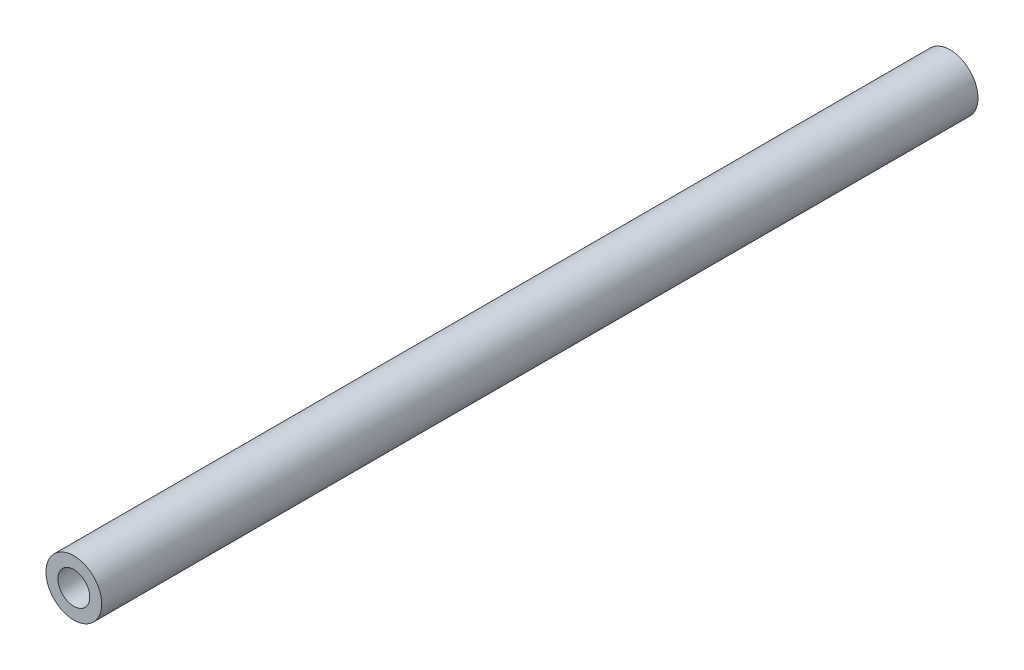
from build123d import *

# Parameters (mm, degrees)
SKETCH_1_R      = 7
SKETCH_1_R_2    = 4
EXTRUDE_1_DEPTH = 220


with BuildPart() as part:
    # 스케치1 → 보스-돌출1 (new body)
    with BuildSketch(Plane.XY):
        Circle(SKETCH_1_R)
        Circle(SKETCH_1_R_2, mode=Mode.SUBTRACT)
    extrude(amount=EXTRUDE_1_DEPTH)


solid = part.part
